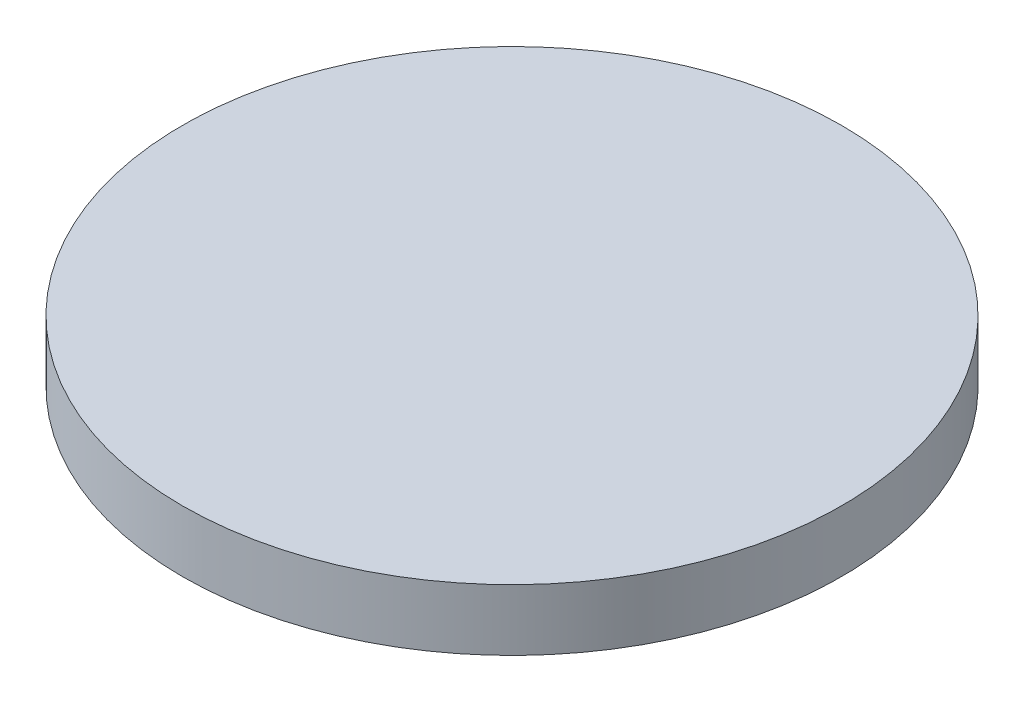
from build123d import *

# Parameters (mm, degrees)
SKETCH1_R           = 21.5
BOSS_EXTRUDE1_DEPTH = 4


with BuildPart() as part:
    # Sketch1 → Boss-Extrude1 (new body)
    with BuildSketch(Plane(origin=(0, 0, 0), x_dir=(1, 0, 0), z_dir=(0, 1, 0))):
        with Locations(Location((0, 0, 0), (0, 0, 270))):
            Circle(SKETCH1_R)
    extrude(amount=BOSS_EXTRUDE1_DEPTH)


solid = part.part
